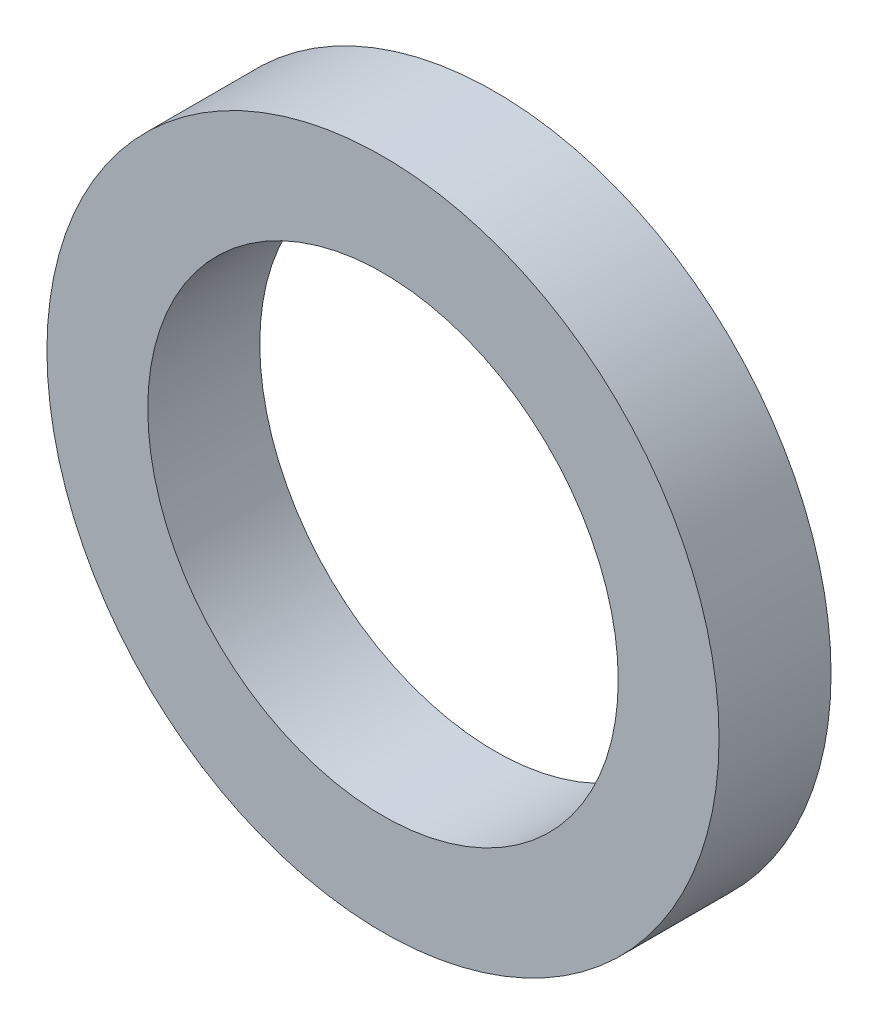
from build123d import *

# Parameters (mm, degrees)
SKETCH1_R    = 1.5
SKETCH1_R_2  = 1.05
SPACER_DEPTH = 0.5


with BuildPart() as part:
    # Sketch1 → Spacer (new body)
    with BuildSketch(Plane.XY):
        Circle(SKETCH1_R)
        Circle(SKETCH1_R_2, mode=Mode.SUBTRACT)
    extrude(amount=SPACER_DEPTH)


solid = part.part
